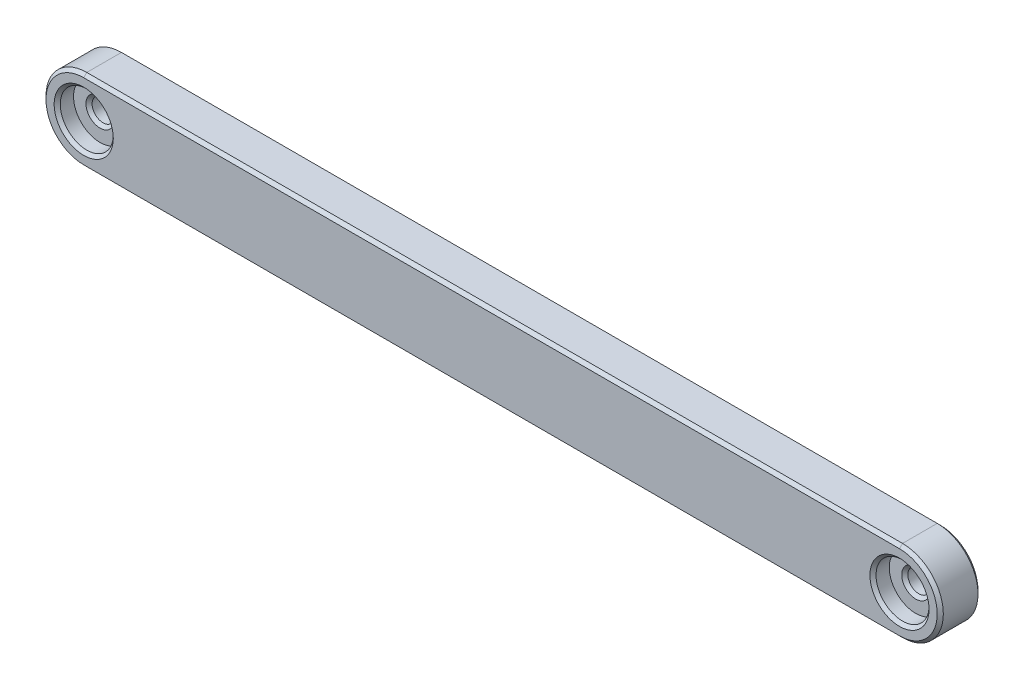
from build123d import *

# Parameters (mm, degrees)
SKETCH1_R           = 2.7
BOSS_EXTRUDE1_DEPTH = 10
SKETCH2_R           = 6.5
CUT_EXTRUDE1_DEPTH  = 4
CHAMFER1_SIZE       = 0.75


with BuildPart() as part:
    # Sketch1 → Boss-Extrude1 (new body)
    with BuildSketch(Plane.XY):
        with BuildLine():
            Line((-100, 10), (100, 10))
            ThreePointArc((100, 10), (110, 0), (100, -10))
            Line((100, -10), (-100, -10))
            ThreePointArc((-100, -10), (-110, 0), (-100, 10))
        make_face()
        with Locations((100, 0)):
            Circle(SKETCH1_R, mode=Mode.SUBTRACT)
        with Locations((-100, 0)):
            Circle(SKETCH1_R, mode=Mode.SUBTRACT)
    extrude(amount=BOSS_EXTRUDE1_DEPTH)

    # Sketch2 → Cut-Extrude1 (cut)
    with BuildSketch(Plane.XY.offset(10)):
        with Locations((-100, 0)):
            Circle(SKETCH2_R)
        with Locations((100, 0)):
            Circle(SKETCH2_R)
    extrude(amount=-CUT_EXTRUDE1_DEPTH, mode=Mode.SUBTRACT)

    # Chamfer1
    chamfer1_edges = [part.edges().sort_by_distance(p)[0] for p in [
        (0, 10, 10),
        (-110, 0, 10),
        (0, -10, 10),
        (-102.7, 0, 6),
        (-106.5, 0, 10),
        (110, 0, 10),
        (97.3, 0, 6),
        (93.5, 0, 10),
        (-102.7, 0, 0),
        (110, 0, 0),
        (0, -10, 0),
        (-110, 0, 0),
        (0, 10, 0),
        (97.3, 0, 0),
    ]]
    chamfer(chamfer1_edges, length=CHAMFER1_SIZE)


solid = part.part
